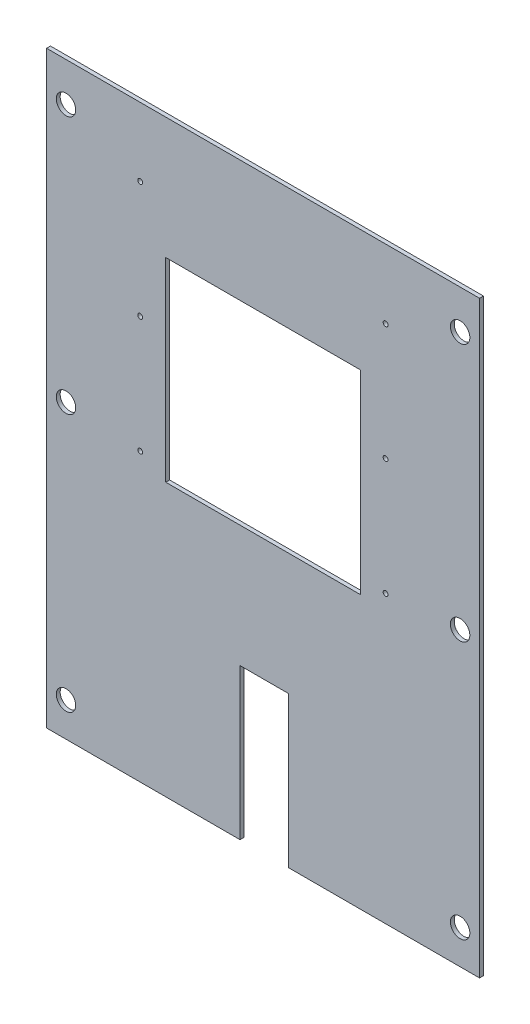
from build123d import *

# Parameters (mm, degrees)
SKETCH1_R           = 6.35
SKETCH1_R_2         = 1.5875
SKETCH1_W           = 127
SKETCH1_H           = 127
BOSS_EXTRUDE1_DEPTH = 2.54


with BuildPart() as part:
    # Sketch1 → Boss-Extrude1 (new body)
    with BuildSketch(Plane.XY):
        Polygon((141.2875, 192.0875), (-141.2875, 192.0875), (-141.2875, -192.0875), (-15.008193375, -192.0875), (-15.008193375, -93.6625), (16.741806625, -93.6625), (16.741806625, -192.0875), (141.2875, -192.0875), align=None)
        with Locations((-128.5875, -169.8625)):
            Circle(SKETCH1_R, mode=Mode.SUBTRACT)
        with Locations((-128.5875, -1.5875)):
            Circle(SKETCH1_R, mode=Mode.SUBTRACT)
        with Locations((-80.175152311, -5.023613243)):
            Circle(SKETCH1_R_2, mode=Mode.SUBTRACT)
        with Locations((128.5875, -169.8625)):
            Circle(SKETCH1_R, mode=Mode.SUBTRACT)
        with Locations((79.970650499, -5.395164494)):
            Circle(SKETCH1_R_2, mode=Mode.SUBTRACT)
        with Locations((128.5875, -1.5875)):
            Circle(SKETCH1_R, mode=Mode.SUBTRACT)
        with Locations((-80.175152311, 71.176386757)):
            Circle(SKETCH1_R_2, mode=Mode.SUBTRACT)
        with Locations((-0.006402311, 49.2125)):
            Rectangle(SKETCH1_W, SKETCH1_H, mode=Mode.SUBTRACT)
        with Locations((-128.5875, 166.6875)):
            Circle(SKETCH1_R, mode=Mode.SUBTRACT)
        with Locations((-80.175152311, 147.376386757)):
            Circle(SKETCH1_R_2, mode=Mode.SUBTRACT)
        with Locations((79.970650499, 70.804835506)):
            Circle(SKETCH1_R_2, mode=Mode.SUBTRACT)
        with Locations((79.970650499, 147.004835506)):
            Circle(SKETCH1_R_2, mode=Mode.SUBTRACT)
        with Locations((128.5875, 166.6875)):
            Circle(SKETCH1_R, mode=Mode.SUBTRACT)
    extrude(amount=BOSS_EXTRUDE1_DEPTH)


solid = part.part
